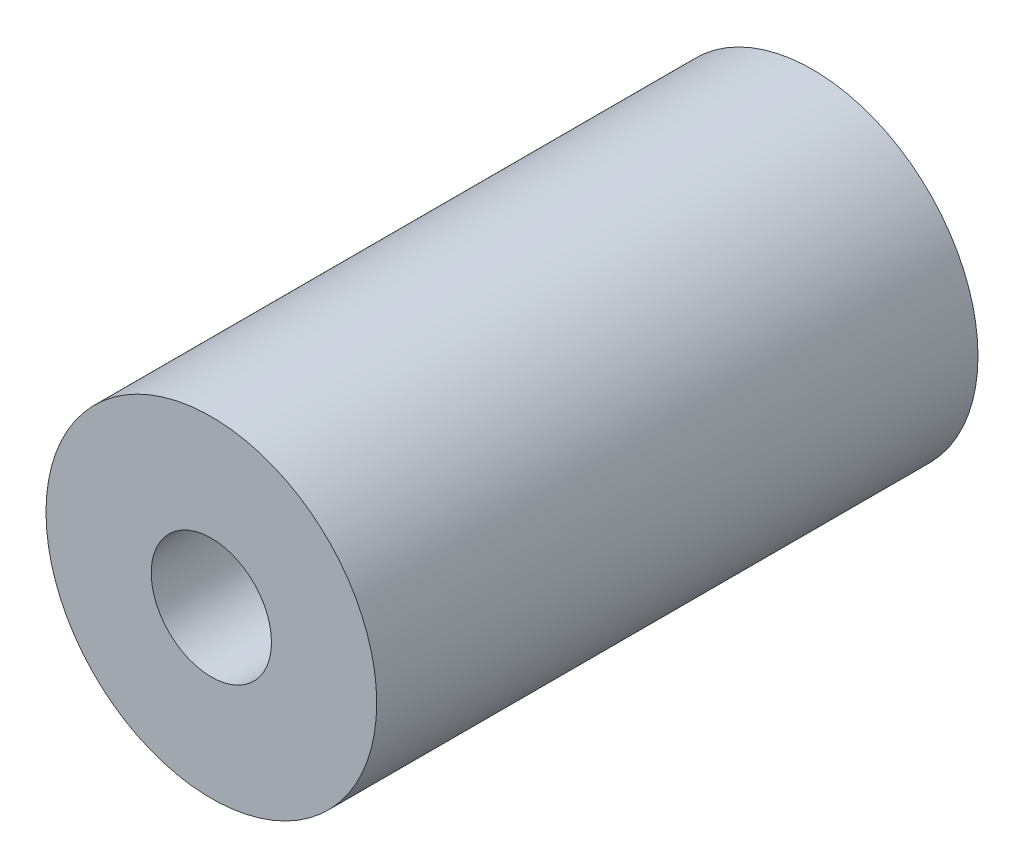
from build123d import *

# Parameters (mm, degrees)
SKETCH1_R           = 6.985
SKETCH1_R_2         = 2.54
BOSS_EXTRUDE1_DEPTH = 25.4


with BuildPart() as part:
    # Sketch1 → Boss-Extrude1 (new body)
    with BuildSketch(Plane.XY):
        Circle(SKETCH1_R)
        Circle(SKETCH1_R_2, mode=Mode.SUBTRACT)
    extrude(amount=BOSS_EXTRUDE1_DEPTH)


solid = part.part
